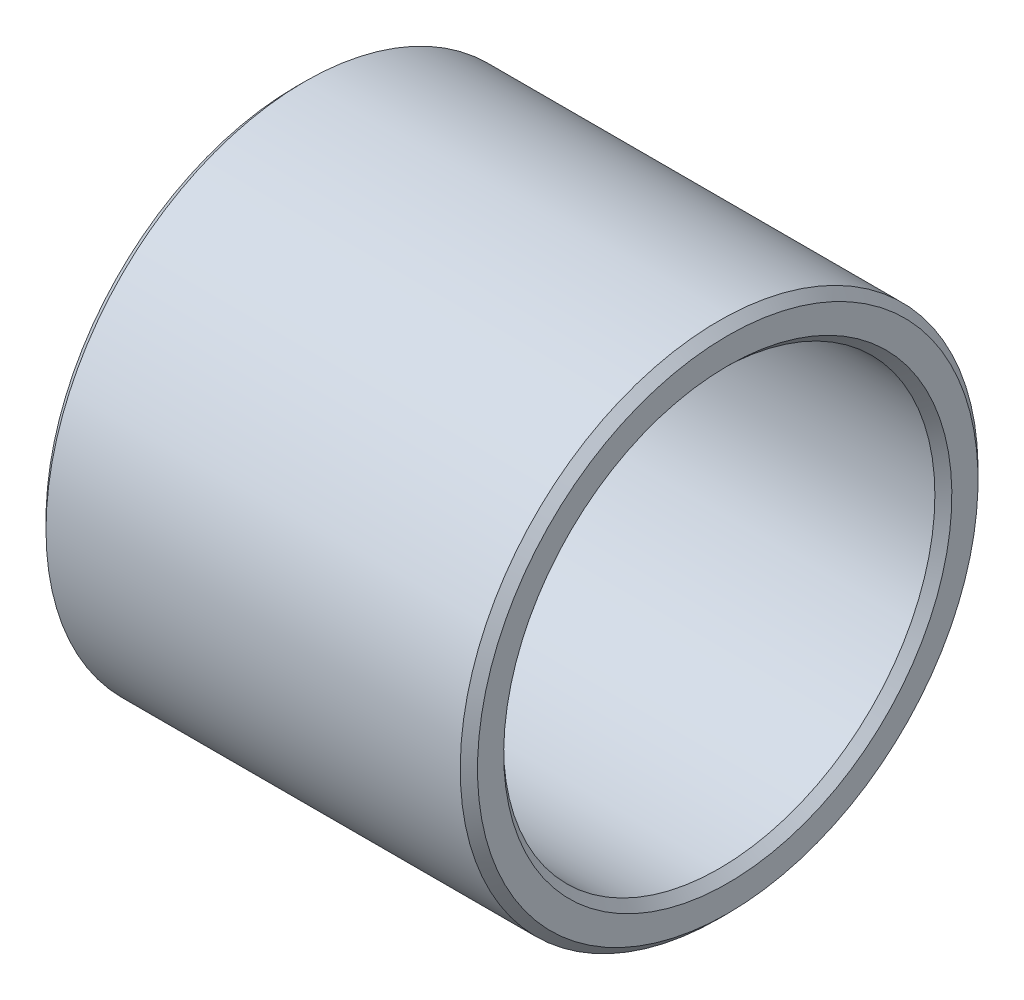
from build123d import *


with BuildPart() as part:
    # Sketch 181 → 旋转1 (revolve)
    with BuildSketch(Plane.XY, mode=Mode.PRIVATE) as revolve_1_sk:
        Polygon((-12.5, 12.982844387), (-12, 12.5), (12, 12.5), (12.5, 12.982844387), (12.5, 14.5), (12, 15), (-12, 15), (-12.5, 14.5), align=None)
    revolve(revolve_1_sk.sketch.rotate(Axis((-12.5, 0, 0), (1, 0, 0)), 180), axis=Axis((-12.5, 0, 0), (1, 0, 0)))


solid = part.part
